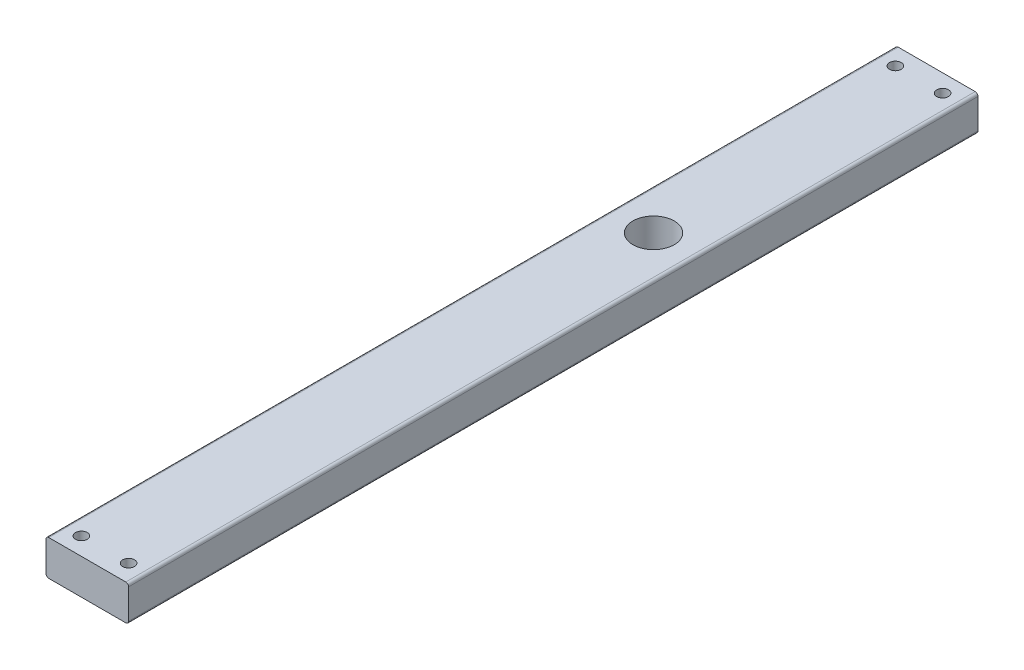
from build123d import *

# Parameters (mm, degrees)
BOSS_EXTRUDE1_DEPTH        = 914.4
SKETCH2_R                  = 22.225
CUT_EXTRUDE1_DEPTH         = 917.272215283
F_1_2_0_5_DIAMETER_HOLE1_D = 12.7


with BuildPart() as part:
    # Sketch1 → Boss-Extrude1 (new body)
    with BuildSketch(Plane.XY):
        with BuildLine():
            Line((41.45, -19.05), (-41.45, -19.05))
            ThreePointArc((-41.45, -19.05), (-43.571320344, -18.171320344), (-44.45, -16.05))
            Line((-44.45, -16.05), (-44.45, 16.05))
            ThreePointArc((-44.45, 16.05), (-43.571320344, 18.171320344), (-41.45, 19.05))
            Line((-41.45, 19.05), (41.45, 19.05))
            ThreePointArc((41.45, 19.05), (43.571320344, 18.171320344), (44.45, 16.05))
            Line((44.45, 16.05), (44.45, -16.05))
            ThreePointArc((44.45, -16.05), (43.571320344, -18.171320344), (41.45, -19.05))
        make_face()
    extrude(amount=BOSS_EXTRUDE1_DEPTH)

    # Sketch2 → Cut-Extrude1 (cut, through all)
    with BuildSketch(Plane(origin=(0, 19.05, 0), x_dir=(1, 0, 0), z_dir=(0, 1, 0))):
        with Locations(Location((0, -304.8, 0), (0, 0, 180))):
            Circle(SKETCH2_R)
    extrude(amount=-CUT_EXTRUDE1_DEPTH, mode=Mode.SUBTRACT)

    # 1/2 (0.5) Diameter Hole1 (through all)
    with Locations(Plane(origin=(0, 19.05, 0), x_dir=(1, 0, 0), z_dir=(0, 1, 0))):
        with Locations((-25.4, -895.35), (25.4, -895.35), (-25.4, -19.05), (25.4, -19.05)):
            Hole(F_1_2_0_5_DIAMETER_HOLE1_D / 2)


solid = part.part
